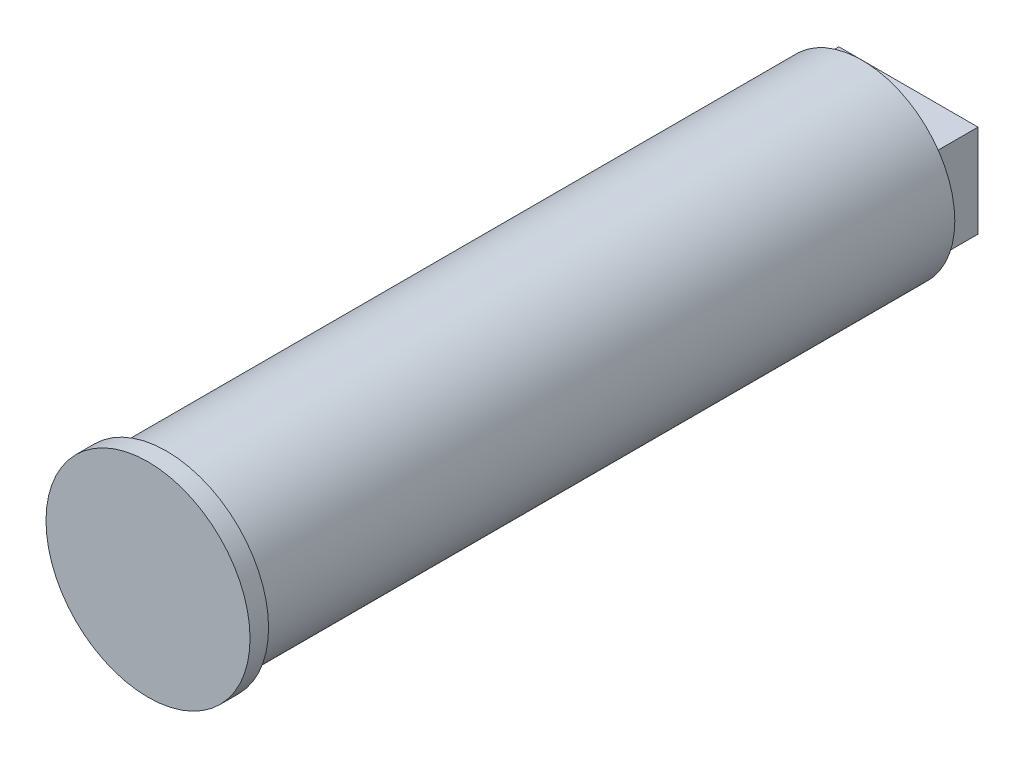
from build123d import *

# Parameters (mm, degrees)
CROQUIS1_R              = 10
SALIENTE_EXTRUIR1_DEPTH = 75
CROQUIS2_R              = 11
SALIENTE_EXTRUIR2_DEPTH = 2
CROQUIS3_W              = 15
CROQUIS3_H              = 10
SALIENTE_EXTRUIR3_DEPTH = 5


with BuildPart() as part:
    # Croquis1 → Saliente-Extruir1 (new body)
    with BuildSketch(Plane.XY):
        Circle(CROQUIS1_R)
    extrude(amount=SALIENTE_EXTRUIR1_DEPTH)

    # Croquis2 → Saliente-Extruir2 (add)
    with BuildSketch(Plane.XY.offset(75)):
        Circle(CROQUIS2_R)
    extrude(amount=SALIENTE_EXTRUIR2_DEPTH)

    # Croquis3 → Saliente-Extruir3 (add)
    with BuildSketch(Plane(origin=(0, 0, 0), x_dir=(-1, 0, 0), z_dir=(0, 0, -1))):
        Rectangle(CROQUIS3_W, CROQUIS3_H)
    extrude(amount=SALIENTE_EXTRUIR3_DEPTH)


solid = part.part
